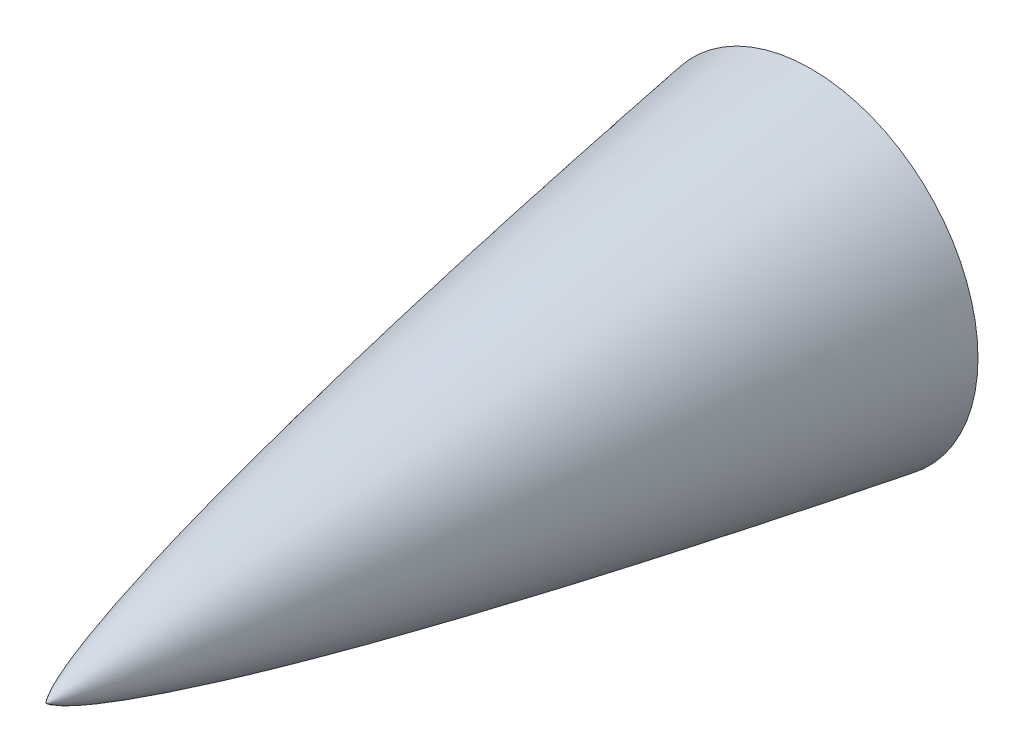
from build123d import *

# Parameters (mm, degrees)
F_1_4_20_TAPPED_HOLE1_D     = 5.1054
F_1_4_20_TAPPED_HOLE1_DEPTH = 19.812
F_1_4_20_TAPPED_HOLE1_TIP   = 1.533816902


with BuildPart() as part:
    # Sketch1 → Revolve1 (revolve)
    with BuildSketch(Plane(origin=(0, 0, 0), x_dir=(0, 0, -1), z_dir=(1, 0, 0))):
        with BuildLine():
            Line((65.786, 0), (65.786, 14.35154156))
            add(Edge.make_bspline(
                [(0, 0), (0.00273266, 0.007589179), (0.009918459, 0.021881358), (0.028599022, 0.04513016), (0.058159853, 0.076190245), (0.098068862, 0.112001745), (0.154490996, 0.157289413), (0.237015744, 0.21684464), (0.369066217, 0.302486025), (0.586708146, 0.428563317), (0.961032305, 0.621069751), (1.616409937, 0.918059517), (2.771963001, 1.376152359), (4.708581304, 2.045239073), (7.850265694, 2.995369148), (12.07298984, 4.119063851), (17.135806504, 5.335036279), (22.717497971, 6.568884535), (28.316163012, 7.729364413), (33.924351731, 8.83181844), (39.544969972, 9.887825848), (45.167043001, 10.903272486), (50.101072382, 11.763325335), (54.318415677, 12.479431193), (57.858660956, 13.068319392), (60.649305367, 13.526411789), (63.036085612, 13.912052875), (64.635199114, 14.168373305), (65.561696399, 14.315885864), (65.786, 14.35154156)],
                knots=[0, 0, 0, 0, 0, 0.000374612, 0.000749224, 0.001377825, 0.002004142, 0.002870785, 0.004124517, 0.006122153, 0.009343455, 0.014598521, 0.02375129, 0.039673749, 0.067305341, 0.110150454, 0.176816979, 0.243483507, 0.310150042, 0.376816576, 0.44348311, 0.510149643, 0.576816176, 0.643482711, 0.676815979, 0.710149246, 0.743482512, 0.776815779, 0.787395269, 0.787395269, 0.787395269, 0.787395269, 0.787395269], degree=4))
            Line((0, 0), (65.786, 0))
        make_face()
    revolve(axis=Axis((0, 0, -76.2), (0, 0, 1)))

    # 1/4-20 Tapped Hole1
    with Locations(Plane(origin=(0, 0, -65.786), x_dir=(-1, 0, 0), z_dir=(0, 0, -1))):
        with Locations((0, 0)):
            Hole(F_1_4_20_TAPPED_HOLE1_D / 2, depth=F_1_4_20_TAPPED_HOLE1_DEPTH)
            with Locations((0, 0, -(F_1_4_20_TAPPED_HOLE1_DEPTH + F_1_4_20_TAPPED_HOLE1_TIP / 2))):  # 118° drill point
                Cone(0, F_1_4_20_TAPPED_HOLE1_D / 2, F_1_4_20_TAPPED_HOLE1_TIP, mode=Mode.SUBTRACT)


solid = part.part
